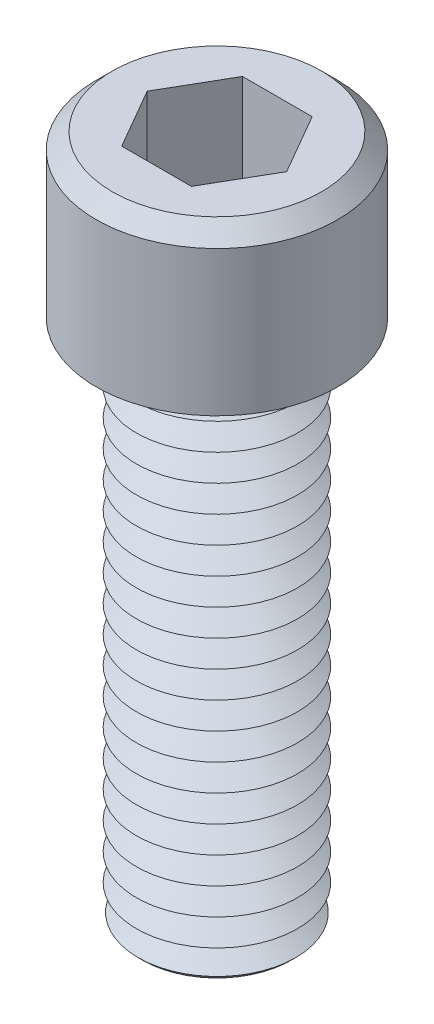
from build123d import *

# Parameters (mm, degrees)
HEX_CUT_DRIVEN_DEPTH = 3.3782


with BuildPart() as part:
    # Sketch3 → Shank Revolve ( driven ) (revolve)
    with BuildSketch(Plane.XY, mode=Mode.PRIVATE) as shank_revolve_driven_sk:
        Polygon((0, 1.4478), (0, -15.875), (1.9304, -15.875), (2.413, -15.3924), (2.413, 1.4478), align=None)
    revolve(shank_revolve_driven_sk.sketch.rotate(Axis((0, -50, 0), (0, 1, 0)), 90), axis=Axis((0, -50, 0), (0, 1, 0)))

    # Sketch4 → Thread Revolve Cut ( driven ) (revolve, cut)
    with BuildSketch(Plane.XY, mode=Mode.PRIVATE) as thread_revolve_cut_driven_sk:
        Polygon((1.7164269, 3.429), (2.413, 3.831166667), (3.217333333, 3.831166667), (3.217333333, -17.885833333), (2.413, -17.885833333), (1.7164269, -17.483666667), (2.413, -17.0815), (1.7164269, -16.679333333), (2.413, -16.277166667), (1.7164269, -15.875), (2.413, -15.472833333), (1.7164269, -15.070666667), (2.413, -14.6685), (1.7164269, -14.266333333), (2.413, -13.864166667), (1.7164269, -13.462), (2.413, -13.059833333), (1.7164269, -12.657666667), (2.413, -12.2555), (1.7164269, -11.853333333), (2.413, -11.451166667), (1.7164269, -11.049), (2.413, -10.646833333), (1.7164269, -10.244666667), (2.413, -9.8425), (1.7164269, -9.440333333), (2.413, -9.038166667), (1.7164269, -8.636), (2.413, -8.233833333), (1.7164269, -7.831666667), (2.413, -7.4295), (1.7164269, -7.027333333), (2.413, -6.625166667), (1.7164269, -6.223), (2.413, -5.820833333), (1.7164269, -5.418666667), (2.413, -5.0165), (1.7164269, -4.614333333), (2.413, -4.212166667), (1.7164269, -3.81), (2.413, -3.407833333), (1.7164269, -3.005666667), (2.413, -2.6035), (1.7164269, -2.201333333), (2.413, -1.799166667), (1.7164269, -1.397), (2.413, -0.994833333), (1.7164269, -0.592666667), (2.413, -0.1905), (1.7164269, 0.211666667), (2.413, 0.613833333), (1.7164269, 1.016), (2.413, 1.418166667), (1.7164269, 1.820333333), (2.413, 2.2225), (1.7164269, 2.624666667), (2.413, 3.026833333), align=None)
    revolve(thread_revolve_cut_driven_sk.sketch.rotate(Axis((0, -50, 0), (0, 1, 0)), 90), axis=Axis((0, -50, 0), (0, 1, 0)), mode=Mode.SUBTRACT)

    # Sketch5 → Head Revolve ( driven ) (revolve)
    with BuildSketch(Plane.XY, mode=Mode.PRIVATE) as head_revolve_driven_sk:
        Polygon((0, 4.826), (0, 0), (3.6195, 0), (3.6195, 4.3434), (3.1369, 4.826), align=None)
    revolve(head_revolve_driven_sk.sketch.rotate(Axis((0, -50, 0), (0, 1, 0)), 90), axis=Axis((0, -50, 0), (0, 1, 0)))

    # Sketch2 → Hex Cut ( driven ) (cut)
    with BuildSketch(Plane(origin=(0, 4.826, 0), x_dir=(-1, 0, 0), z_dir=(0, 1, 0))):
        Polygon((-2.089719299, 0), (-1.04485965, -1.80975), (1.04485965, -1.80975), (2.089719299, 0), (1.04485965, 1.80975), (-1.04485965, 1.80975), align=None)
    extrude(amount=-HEX_CUT_DRIVEN_DEPTH, mode=Mode.SUBTRACT)


solid = part.part
